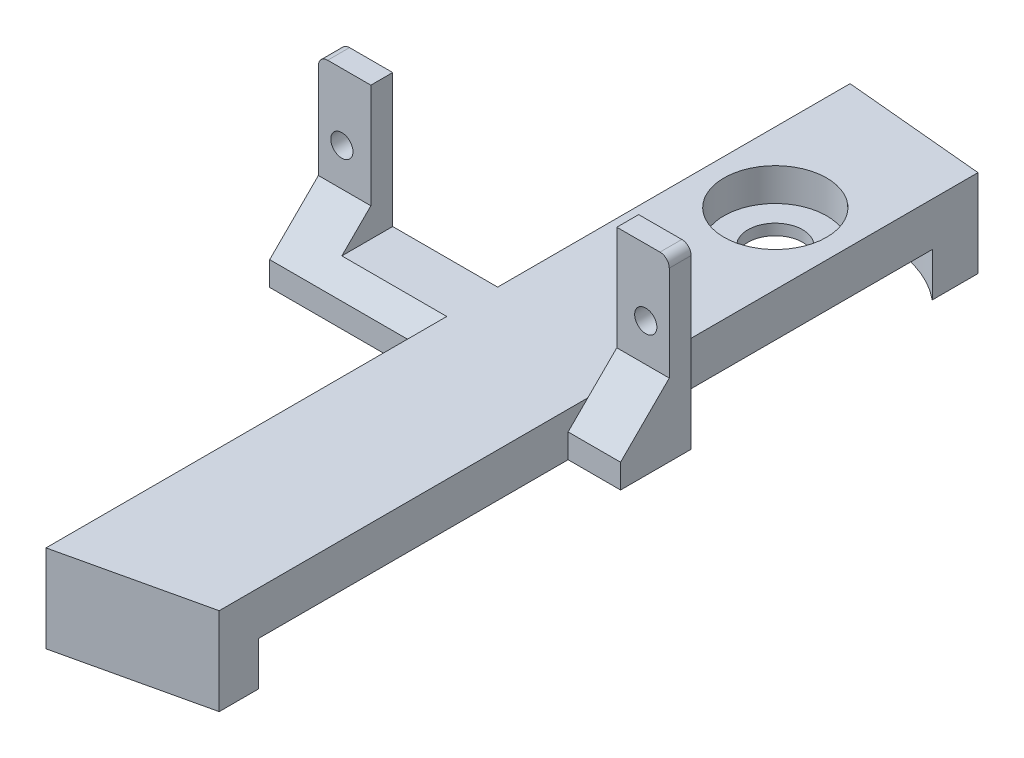
from build123d import *

# Parameters (mm, degrees)
SKETCH1_R                       = 1.016
BOSS_EXTRUDE1_DEPTH             = 2
SKETCH2_R                       = 4.7
BOSS_EXTRUDE2_DEPTH             = 3
BOSS_EXTRUDE5_DEPTH             = 8
BOSS_EXTRUDE6_REACH             = 53.49
BOSS_EXTRUDE6_DIRECTION_2_REACH = 53.49
SKETCH4_W                       = 22.5
SKETCH4_H                       = 14.127681706
CUT_EXTRUDE1_DEPTH              = 7
FILLET1_R                       = 0.5
SKETCH5_R                       = 2.5
BOSS_EXTRUDE7_DEPTH             = 1
SKETCH6_W                       = 5.313656685
SKETCH6_H                       = 4.599259183
SKETCH6_W_2                     = 16.163165117
SKETCH6_H_2                     = 5.344557169
CUT_EXTRUDE2_DEPTH              = 5


with BuildPart() as part:
    # Sketch1 → Boss-Extrude1 (new body)
    # profile 1 of 4: a face of its own
    with BuildSketch(Plane.XY):
        with BuildLine():
            Line((-16.05, 5.25), (-16.05, -5.25))
            ThreePointArc((-16.05, -5.25), (-15.801040764, -5.851040764), (-15.2, -6.1))
            Line((-15.2, -6.1), (-11.25, -6.1))
            Line((-11.25, -6.1), (-11.25, 6.1))
            Line((-11.25, 6.1), (-15.2, 6.1))
            ThreePointArc((-15.2, 6.1), (-15.801040764, 5.851040764), (-16.05, 5.25))
        make_face()
        with Locations((-13.9, 0)):
            Circle(SKETCH1_R, mode=Mode.SUBTRACT)
    # profile 2 of 4: a face of its own
    with BuildSketch(Plane.XY):
        with BuildLine():
            Line((16.05, 5.25), (16.05, -5.25))
            ThreePointArc((16.05, -5.25), (15.801040764, -5.851040764), (15.2, -6.1))
            Line((15.2, -6.1), (11.25, -6.1))
            Line((11.25, -6.1), (11.25, 6.094097151))
            Line((11.25, 6.094097151), (15.2, 6.1))
            ThreePointArc((15.2, 6.1), (15.801040764, 5.851040764), (16.05, 5.25))
        make_face()
        with Locations((13.9, 0)):
            Circle(SKETCH1_R, mode=Mode.SUBTRACT)
    # profile 3 of 4: a face of its own
    with BuildSketch(Plane.XY):
        with BuildLine():
            ThreePointArc((15.2, -6.1), (15.801040764, -5.851040764), (16.05, -5.25))
            Line((16.05, -5.25), (16.05, -6.1))
            Line((16.05, -6.1), (15.2, -6.1))
        make_face()
    # profile 4 of 4: a face of its own
    with BuildSketch(Plane.XY):
        with BuildLine():
            ThreePointArc((-16.05, -5.25), (-15.801040764, -5.851040764), (-15.2, -6.1))
            Line((-15.2, -6.1), (-16.05, -6.1))
            Line((-16.05, -6.1), (-16.05, -5.25))
        make_face()
    extrude(amount=BOSS_EXTRUDE1_DEPTH)

    # Sketch2 → Boss-Extrude2 (add)
    with BuildSketch(Plane.XZ.offset(6.1)):
        Polygon((16.05, 2), (11.25, 2), (11.25, 38.372960525), (-1.65, 41.317302208), (-1.65, 22.612965014), (-1.65, 2), (-16.05, 2), (-16.05, 0), (-1.65, 0), (-1.65, -32.240273927), (11.25, -31.043279545), (11.25, 0), (16.05, 0), align=None)
        with Locations((4.75, -19)):
            Circle(SKETCH2_R, mode=Mode.SUBTRACT)
    extrude(amount=BOSS_EXTRUDE2_DEPTH)

    # Sketch2<3> → Boss-Extrude5 (add)
    with BuildSketch(Plane.XZ.offset(6.1)):
        with BuildLine():
            ThreePointArc((7.17535625, 36.893660937), (9.334777443, 36.079294831), (11.25, 34.791578013))
            Line((11.25, 34.791578013), (11.25, 38.372960525))
            Line((11.25, 38.372960525), (-1.65, 41.317302208))
            Line((-1.65, 41.317302208), (-1.65, 39.1))
            Line((-1.65, 39.1), (7.17535625, 36.893660937))
        make_face()
        with BuildLine():
            ThreePointArc((0.350023778, -29.2), (-0.651218811, -29.175170712), (-1.65, -29.100743889))
            Line((-1.65, -29.100743889), (-1.65, -32.240273927))
            Line((-1.65, -32.240273927), (11.25, -31.043279545))
            Line((11.25, -31.043279545), (11.25, -26.86066155))
            ThreePointArc((11.25, -26.86066155), (8.204073841, -28.597362862), (4.75, -29.2))
            Line((4.75, -29.2), (0.350023778, -29.2))
        make_face()
    extrude(amount=BOSS_EXTRUDE5_DEPTH)

    # Boss-Extrude6: up to this face of the body (flat: up to its plane)
    boss_extrude6_end = Plane(part.part.faces().sort_by_distance((16.05, -1.925, 1))[0])
    # Sketch3 → Boss-Extrude6 (add, up to the picked face)
    with BuildSketch(Plane(origin=(11.25, 0, 0), x_dir=(0, 0, -1), z_dir=(1, 0, 0)), mode=Mode.PRIVATE) as boss_extrude6_sk1:
        Polygon((-7.665828596, -9.1), (-2, -3.457464127), (-2, -9.1), align=None)
    boss_extrude6_tool1 = split(extrude(boss_extrude6_sk1.sketch, amount=BOSS_EXTRUDE6_REACH, mode=Mode.PRIVATE), bisect_by=boss_extrude6_end, keep=Keep.BOTH, mode=Mode.PRIVATE)
    add(boss_extrude6_tool1.solids().sort_by(Axis((11.25, -7.219155, 3.88861), (1, 0, 0)))[0])

    # Boss-Extrude6 direction 2: up to this face of the body (flat: up to its plane)
    boss_extrude6_direction_2_end = Plane(part.part.faces().sort_by_distance((-16.05, -1.925, 1))[0])
    # Sketch3 → Boss-Extrude6 direction 2 (add, up to the picked face)
    with BuildSketch(Plane(origin=(11.25, 0, 0), x_dir=(0, 0, -1), z_dir=(1, 0, 0)), mode=Mode.PRIVATE) as boss_extrude6_direction_2_sk1:
        Polygon((-7.665828596, -9.1), (-2, -3.457464127), (-2, -9.1), align=None)
    boss_extrude6_direction_2_tool1 = split(extrude(boss_extrude6_direction_2_sk1.sketch, amount=-BOSS_EXTRUDE6_DIRECTION_2_REACH, mode=Mode.PRIVATE), bisect_by=boss_extrude6_direction_2_end, keep=Keep.BOTH, mode=Mode.PRIVATE)
    add(boss_extrude6_direction_2_tool1.solids().sort_by(Axis((11.25, -7.219155, 3.88861), (-1, 0, 0)))[0])

    # Sketch4 → Cut-Extrude1 (cut)
    with BuildSketch(Plane(origin=(0, -6.1, 0), x_dir=(1, 0, 0), z_dir=(0, 1, 0))):
        with Locations((0, -7.063840853)):
            Rectangle(SKETCH4_W, SKETCH4_H)
    extrude(amount=CUT_EXTRUDE1_DEPTH, mode=Mode.SUBTRACT)

    # Fillet1
    fillet1_edges = [part.edges().sort_by_distance(p)[0] for p in [
        (13.65, -9.1, 7.665828596),
        (-8.85, -9.1, 7.665828596),
    ]]
    fillet(fillet1_edges, radius=FILLET1_R)

    # Sketch5 → Boss-Extrude7 (add)
    with BuildSketch(Plane.XZ.offset(9.1)):
        with BuildLine():
            Line((-1.65, 39.1), (-1.65, 6.455196792))
            Line((-1.65, 6.455196792), (-16.05, 6.455196792))
            Line((-16.05, 6.455196792), (-16.05, 0))
            Line((-16.05, 0), (-1.65, 0))
            Line((-1.65, 0), (-1.65, -29.100743889))
            ThreePointArc((-1.65, -29.100743889), (-0.651218811, -29.175170712), (0.350023778, -29.2))
            Line((0.350023778, -29.2), (4.75, -29.2))
            ThreePointArc((4.75, -29.2), (8.204073841, -28.597362862), (11.25, -26.86066155))
            Line((11.25, -26.86066155), (11.25, 0))
            Line((11.25, 0), (16.05, 0))
            Line((16.05, 0), (16.05, 6.455196792))
            Line((16.05, 6.455196792), (11.25, 6.455196792))
            Line((11.25, 6.455196792), (11.25, 34.791578013))
            ThreePointArc((11.25, 34.791578013), (9.334777443, 36.079294831), (7.17535625, 36.893660937))
            Line((7.17535625, 36.893660937), (-1.65, 39.1))
        make_face()
        with Locations((4.75, -19)):
            Circle(SKETCH5_R, mode=Mode.SUBTRACT)
    extrude(amount=BOSS_EXTRUDE7_DEPTH)

    # Sketch6 → Cut-Extrude2 (cut)
    with BuildSketch(Plane.XY.offset(6.455196792)):
        with Locations((13.906828343, -7.800370409)):
            Rectangle(SKETCH6_W, SKETCH6_H)
        with Locations((-9.731582558, -7.427721416)):
            Rectangle(SKETCH6_W_2, SKETCH6_H_2)
    extrude(amount=CUT_EXTRUDE2_DEPTH, mode=Mode.SUBTRACT)


solid = part.part
